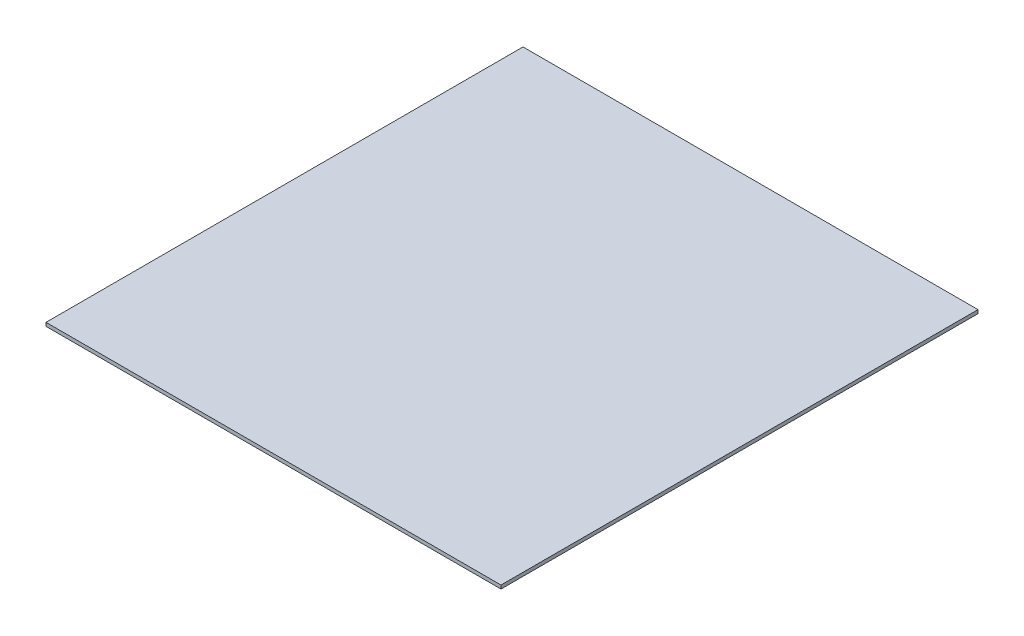
from build123d import *

# Parameters (mm, degrees)
SKETCH2_W           = 196.85
SKETCH2_H           = 206.375
BOSS_EXTRUDE1_DEPTH = 1.524


with BuildPart() as part:
    # Sketch2 → Boss-Extrude1 (new body)
    with BuildSketch(Plane(origin=(0, 0, 0), x_dir=(1, 0, 0), z_dir=(0, 1, 0))):
        Rectangle(SKETCH2_W, SKETCH2_H)
    extrude(amount=BOSS_EXTRUDE1_DEPTH)


solid = part.part
